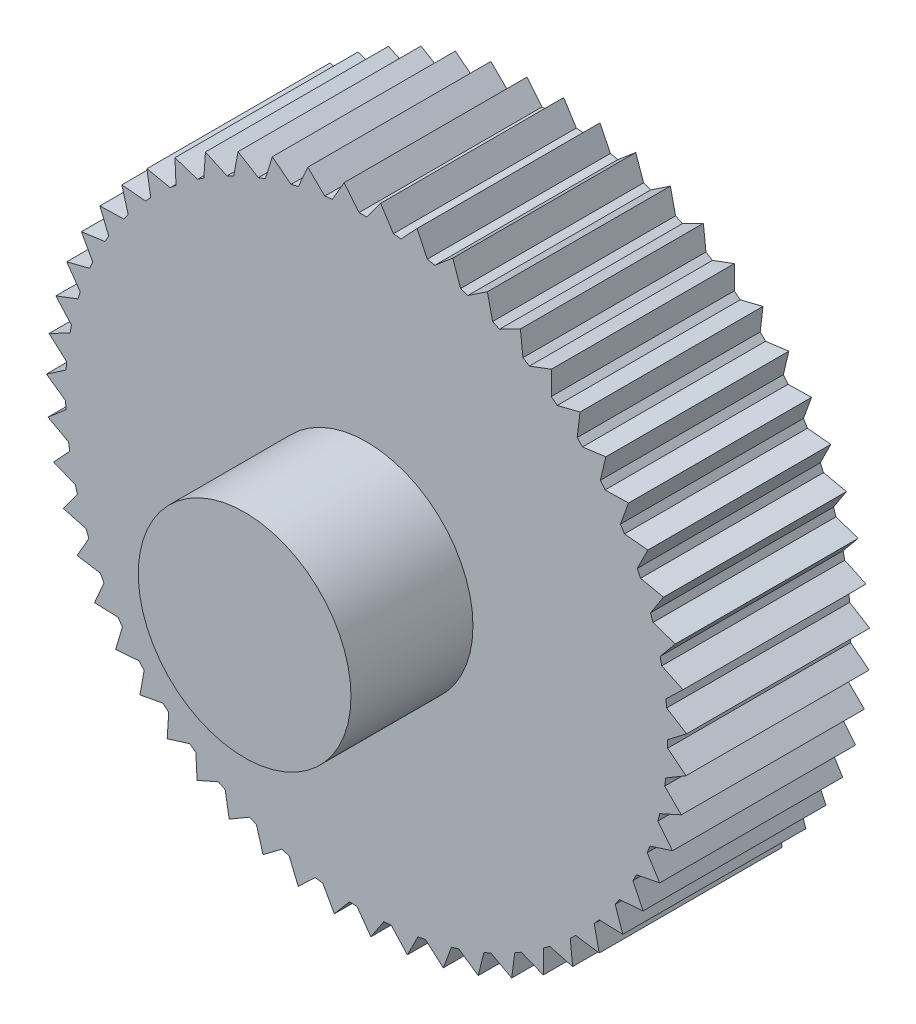
from build123d import *

# Parameters (mm, degrees)
SKETCH1_R           = 8.717247156
BOSS_EXTRUDE1_DEPTH = 15
SKETCH2_R           = 8.717247156
BOSS_EXTRUDE2_DEPTH = 10
FILLET1_R           = 1
BOSS_EXTRUDE3_START = 5
SKETCH3_R           = 8.717247156
BOSS_EXTRUDE3_DEPTH = 5


with BuildPart() as part:
    # Sketch1 → Boss-Extrude1 (new body)
    with BuildSketch(Plane.XY):
        with BuildLine():
            Line((0, 24.68), (1.150167037, 26.224271033))
            Line((1.150167037, 26.224271033), (2.192302243, 24.582437041))
            ThreePointArc((2.192302243, 24.582437041), (2.503005281, 24.552746579), (2.813307996, 24.519129228))
            Line((2.813307996, 24.519129228), (4.132011572, 25.922225132))
            Line((4.132011572, 25.922225132), (4.980198894, 24.172298587))
            ThreePointArc((4.980198894, 24.172298587), (5.285492229, 24.107384178), (5.58994022, 24.03861411))
            Line((5.58994022, 24.03861411), (7.059989017, 25.282243384))
            Line((7.059989017, 25.282243384), (7.703171035, 23.447037254))
            ThreePointArc((7.703171035, 23.447037254), (7.999074703, 23.347745156), (8.293699025, 23.244718895))
            Line((8.293699025, 23.244718895), (9.895928709, 24.312668928))
            Line((9.895928709, 24.312668928), (10.325720562, 22.416107933))
            ThreePointArc((10.325720562, 22.416107933), (10.608377006, 22.283732571), (10.889336779, 22.14779322))
            Line((10.889336779, 22.14779322), (12.602859836, 23.026141652))
            Line((12.602859836, 23.026141652), (12.81365853, 21.092950364))
            ThreePointArc((12.81365853, 21.092950364), (13.07938289, 20.929217453), (13.343015375, 20.76213719))
            Line((13.343015375, 20.76213719), (15.145493411, 21.439433406))
            Line((15.145493411, 21.439433406), (15.134550864, 19.49481393))
            ThreePointArc((15.134550864, 19.49481393), (15.379879016, 19.301857979), (15.62274736, 19.105814951))
            Line((15.62274736, 19.105814951), (17.490682318, 19.573229357))
            Line((17.490682318, 19.573229357), (17.258141181, 17.642532782))
            ThreePointArc((17.258141181, 17.642532782), (17.479874899, 17.422869267), (17.698812941, 17.200419194))
            Line((17.698812941, 17.200419194), (19.607853432, 17.451858331))
            Line((19.607853432, 17.451858331), (19.156745236, 15.560254239))
            ThreePointArc((19.156745236, 15.560254239), (19.351993881, 15.31674681), (19.544147429, 15.070789669))
            Line((19.544147429, 15.070789669), (21.469406191, 15.102975642))
            Line((21.469406191, 15.102975642), (20.805611819, 13.275123985))
            ThreePointArc((20.805611819, 13.275123985), (20.971830027, 13.010947134), (21.134694067, 12.744689353))
            Line((21.134694067, 12.744689353), (23.051072406, 12.557202569))
            Line((23.051072406, 12.557202569), (22.183245435, 10.816932189))
            ThreePointArc((22.183245435, 10.816932189), (22.318266296, 10.535529865), (22.449717645, 10.252442521))
            Line((22.449717645, 10.252442521), (24.332232641, 9.847727156))
            Line((24.332232641, 9.847727156), (23.271686521, 8.217725139))
            ThreePointArc((23.271686521, 8.217725139), (23.373749833, 7.922765851), (23.472074822, 7.626539421))
            Line((23.472074822, 7.626539421), (25.296185012, 7.009871559))
            Line((25.296185012, 7.009871559), (24.056745584, 5.511387475))
            ThreePointArc((24.056745584, 5.511387475), (24.124520796, 5.206716469), (24.188437608, 4.901212717))
            Line((24.188437608, 4.901212717), (25.930362925, 4.080631567))
            Line((25.930362925, 4.080631567), (24.528188179, 2.733200446))
            ThreePointArc((24.528188179, 2.733200446), (24.560791736, 2.422789574), (24.589467118, 2.111991209))
            Line((24.589467118, 2.111991209), (26.226498903, 1.098194302))
            Line((26.226498903, 1.098194302), (24.679868329, -0.08061803))
            ThreePointArc((24.679868329, -0.08061803), (24.676875194, -0.392722087), (24.669935319, -0.704763334))
            Line((24.669935319, -0.704763334), (26.180732359, -1.898559606))
            Line((26.180732359, -1.898559606), (24.509808653, -2.893385527))
            ThreePointArc((24.509808653, -2.893385527), (24.471257847, -3.203114016), (24.428793186, -3.512330209))
            Line((24.428793186, -3.512330209), (25.793659931, -4.870562885))
            Line((25.793659931, -4.870562885), (24.020226138, -5.668433319))
            ThreePointArc((24.020226138, -5.668433319), (23.946620229, -5.971748455), (23.869184374, -6.274108488))
            Line((23.869184374, -6.274108488), (25.070327698, -7.779070929))
            Line((25.070327698, -7.779070929), (23.217503241, -8.369584414))
            ThreePointArc((23.217503241, -8.369584414), (23.109801795, -8.66253202), (22.998404241, -8.954094168))
            Line((22.998404241, -8.954094168), (24.020165405, -10.586166887))
            Line((24.020165405, -10.586166887), (22.112104683, -10.961625176))
            ThreePointArc((22.112104683, -10.961625176), (21.971711753, -11.240386232), (21.827804737, -11.517349537))
            Line((21.827804737, -11.517349537), (22.656863521, -13.25525597))
            Line((22.656863521, -13.25525597), (20.718441024, -13.410764391))
            ThreePointArc((20.718441024, -13.410764391), (20.547186846, -13.671704821), (20.372646417, -13.930458642))
            Line((20.372646417, -13.930458642), (20.998194772, -15.75154252))
            Line((20.998194772, -15.75154252), (19.054680802, -15.685073782))
            ThreePointArc((19.054680802, -15.685073782), (18.854797937, -15.924791828), (18.651899495, -16.161962914))
            Line((18.651899495, -16.161962914), (19.065782441, -18.042483624))
            Line((19.065782441, -18.042483624), (17.142513675, -17.75490425))
            ThreePointArc((17.142513675, -17.75490425), (16.916607901, -17.970274821), (16.687996539, -18.182771283))
            Line((16.687996539, -18.182771283), (16.884818479, -20.098213362))
            Line((16.884818479, -20.098213362), (15.006867666, -19.593272388))
            ThreePointArc((15.006867666, -19.593272388), (14.757884011, -19.781487799), (14.506540027, -19.966539421))
            Line((14.506540027, -19.966539421), (14.483735086, -21.891932153))
            Line((14.483735086, -21.891932153), (12.675584187, -21.176212256))
            ThreePointArc((12.675584187, -21.176212256), (12.406768533, -21.334818831), (12.13596858, -21.490013183))
            Line((12.13596858, -21.490013183), (11.893834057, -23.400256128))
            Line((11.893834057, -23.400256128), (10.179055083, -22.483087813))
            ThreePointArc((10.179055083, -22.483087813), (9.893911854, -22.610017873), (9.607186224, -22.733331759))
            Line((9.607186224, -22.733331759), (9.148878711, -24.603521979))
            Line((9.148878711, -24.603521979), (7.54982643, -23.496861937))
            ThreePointArc((7.54982643, -23.496861937), (7.252072903, -23.590460754), (6.953159503, -23.680286589))
            Line((6.953159503, -23.680286589), (6.284653739, -25.486043294))
            Line((6.284653739, -25.486043294), (4.822174243, -24.204318531))
            ThreePointArc((4.822174243, -24.204318531), (4.515692091, -24.263365903), (4.208487714, -24.318532669))
            Line((4.208487714, -24.318532669), (3.338498695, -26.03631506))
            Line((3.338498695, -26.03631506), (2.03165764, -24.596234818))
            ThreePointArc((2.03165764, -24.596234818), (1.720442327, -24.619960971), (1.408951852, -24.639749485))
            Line((1.408951852, -24.639749485), (0.348821215, -26.247163641))
            Line((0.348821215, -26.247163641), (-0.785344727, -24.667501569))
            ThreePointArc((-0.785344727, -24.667501569), (-1.097236034, -24.655597196), (-1.408951852, -24.639749485))
            Line((-1.408951852, -24.639749485), (-2.645403683, -26.115840304))
            Line((-2.645403683, -26.115840304), (-3.592108925, -24.417189713))
            ThreePointArc((-3.592108925, -24.417189713), (-3.900610245, -24.369810006), (-4.208487714, -24.318532669))
            Line((-4.208487714, -24.318532669), (-5.605141698, -25.64405705))
            Line((-5.605141698, -25.64405705), (-6.352044489, -23.848562447))
            ThreePointArc((-6.352044489, -23.848562447), (-6.653134036, -23.766325073), (-6.953159503, -23.680286589))
            Line((-6.953159503, -23.680286589), (-8.491808119, -24.837964294))
            Line((-8.491808119, -24.837964294), (-9.029171439, -22.969032699))
            ThreePointArc((-9.029171439, -22.969032699), (-9.318924051, -22.853009748), (-9.607186224, -22.733331759))
            Line((-9.607186224, -22.733331759), (-11.267770836, -23.70807069))
            Line((-11.267770836, -23.70807069), (-11.588589331, -21.790066483))
            ThreePointArc((-11.588589331, -21.790066483), (-11.863227639, -21.641770491), (-12.13596858, -21.490013183))
            Line((-12.13596858, -21.490013183), (-13.896840927, -22.269106127))
            Line((-13.896840927, -22.269106127), (-13.996932239, -20.327033426))
            ThreePointArc((-13.996932239, -20.327033426), (-14.252875913, -20.148397659), (-14.506540027, -19.966539421))
            Line((-14.506540027, -19.966539421), (-16.344744444, -20.539829709))
            Line((-16.344744444, -20.539829709), (-16.222803729, -18.599006402))
            ThreePointArc((-16.222803729, -18.599006402), (-16.456716152, -18.39235965), (-16.687996539, -18.182771283))
            Line((-16.687996539, -18.182771283), (-18.579569222, -18.5427852))
            Line((-18.579569222, -18.5427852), (-18.237186164, -16.628512887))
            ThreePointArc((-18.237186164, -16.628512887), (-18.446017928, -16.396549106), (-18.651899495, -16.161962914))
            Line((-18.651899495, -16.161962914), (-20.572180901, -16.304007128))
            Line((-20.572180901, -16.304007128), (-20.013818986, -14.441241276))
            ThreePointArc((-20.013818986, -14.441241276), (-20.194847651, -14.186984469), (-20.372646417, -13.930458642))
            Line((-20.372646417, -13.930458642), (-22.296602741, -13.852681389))
            Line((-22.296602741, -13.852681389), (-21.529541071, -12.065706))
            ThreePointArc((-21.529541071, -12.065706), (-21.680406652, -11.792470794), (-21.827804737, -11.517349537))
            Line((-21.827804737, -11.517349537), (-23.730354265, -11.220764763))
            Line((-23.730354265, -11.220764763), (-22.764592663, -9.532875794))
            ThreePointArc((-22.764592663, -9.532875794), (-22.883328395, -9.244224227), (-22.998404241, -8.954094168))
            Line((-22.998404241, -8.954094168), (-24.854744331, -8.442568309))
            Line((-24.854744331, -8.442568309), (-23.702872975, -6.875769973))
            ThreePointArc((-23.702872975, -6.875769973), (-23.787930958, -6.57546506), (-23.869184374, -6.274108488))
            Line((-23.869184374, -6.274108488), (-25.655114795, -5.554310066))
            Line((-25.655114795, -5.554310066), (-24.332150089, -4.129027976))
            ThreePointArc((-24.332150089, -4.129027976), (-24.382421461, -3.82098465), (-24.428793186, -3.512330209))
            Line((-24.428793186, -3.512330209), (-26.121031602, -2.593642896))
            Line((-26.121031602, -2.593642896), (-24.644220416, -1.328457785))
            ThreePointArc((-24.644220416, -1.328457785), (-24.659049813, -1.016691862), (-24.669935319, -0.704763334))
            Line((-24.669935319, -0.704763334), (-26.246420816, 0.400836374))
            Line((-26.246420816, 0.400836374), (-24.635015641, 1.489430886))
            ThreePointArc((-24.635015641, 1.489430886), (-24.614209739, 1.800855059), (-24.589467118, 2.111991209))
            Line((-24.589467118, 2.111991209), (-26.029647795, 3.39009013))
            Line((-26.029647795, 3.39009013), (-24.304655763, 4.287902546))
            ThreePointArc((-24.304655763, 4.287902546), (-24.248485798, 4.59492508), (-24.188437608, 4.901212717))
            Line((-24.188437608, 4.901212717), (-25.473538508, 6.335148877))
            Line((-25.473538508, 6.335148877), (-23.657447528, 7.03047484))
            ThreePointArc((-23.657447528, 7.03047484), (-23.566645762, 7.329093227), (-23.472074822, 7.626539421))
            Line((-23.472074822, 7.626539421), (-24.585342691, 9.197619269))
            Line((-24.585342691, 9.197619269), (-22.701828284, 9.681394143))
            ThreePointArc((-22.701828284, 9.681394143), (-22.577578458, 9.967715434), (-22.449717645, 10.252442521))
            Line((-22.449717645, 10.252442521), (-23.376639332, 11.940184629))
            Line((-23.376639332, 11.940184629), (-21.450255992, 12.206101667))
            ThreePointArc((-21.450255992, 12.206101667), (-21.294177891, 12.476393227), (-21.134694067, 12.744689353))
            Line((-21.134694067, 12.744689353), (-21.86318573, 14.527091421))
            Line((-21.86318573, 14.527091421), (-19.919046808, 14.571683989))
            ThreePointArc((-19.919046808, 14.571683989), (-19.733175149, 14.822422155), (-19.544147429, 15.070789669))
            Line((-19.544147429, 15.070789669), (-20.064712067, 16.924615361))
            Line((-20.064712067, 16.924615361), (-18.128162387, 16.747302125))
            ThreePointArc((-18.128162387, 16.747302125), (-17.914920292, 16.975218141), (-17.698812941, 17.200419194))
            Line((-17.698812941, 17.200419194), (-18.004664197, 19.101501056))
            Line((-18.004664197, 19.101501056), (-16.100949646, 18.704593567))
            ThreePointArc((-16.100949646, 18.704593567), (-15.863117051, 18.906716199), (-15.62274736, 19.105814951))
            Line((-15.62274736, 19.105814951), (-15.709897994, 21.029369474))
            Line((-15.709897994, 21.029369474), (-13.863836403, 20.418042027))
            ThreePointArc((-13.863836403, 20.418042027), (-13.60451382, 20.591736297), (-13.343015375, 20.76213719))
            Line((-13.343015375, 20.76213719), (-13.210329246, 22.683087899))
            Line((-13.210329246, 22.683087899), (-11.44598685, 21.865310083))
            ThreePointArc((-11.44598685, 21.865310083), (-11.168554946, 22.008311621), (-10.889336779, 22.14779322))
            Line((-10.889336779, 22.14779322), (-10.538543653, 24.041097585))
            Line((-10.538543653, 24.041097585), (-8.878921354, 23.027530384))
            ThreePointArc((-8.878921354, 23.027530384), (-8.586996878, 23.137974946), (-8.293699025, 23.244718895))
            Line((-8.293699025, 23.244718895), (-7.729372028, 25.085694798))
            Line((-7.729372028, 25.085694798), (-6.196105541, 23.88955161))
            ThreePointArc((-6.196105541, 23.88955161), (-5.893494174, 23.965999383), (-5.58994022, 24.03861411))
            Line((-5.58994022, 24.03861411), (-4.819436217, 25.803261615))
            Line((-4.819436217, 25.803261615), (-3.432514015, 24.440135997))
            ThreePointArc((-3.432514015, 24.440135997), (-3.12316076, 24.481590366), (-2.813307996, 24.519129228))
            Line((-2.813307996, 24.519129228), (-1.846671685, 26.184443456))
            Line((-1.846671685, 26.184443456), (-0.62417442, 24.672105834))
            ThreePointArc((-0.62417442, 24.672105834), (-0.312112169, 24.67802638), (0, 24.68))
        make_face()
        Circle(SKETCH1_R, mode=Mode.SUBTRACT)
    extrude(amount=BOSS_EXTRUDE1_DEPTH)

    # Fillet1
    fillet1_edges = [part.edges().sort_by_distance(p)[0] for p in [
        (-8.717247156, 0, 0),
    ]]
    fillet(fillet1_edges, radius=FILLET1_R)



with BuildPart() as body_2:
    # Sketch2 → Boss-Extrude2 (new body)
    with BuildSketch(Plane.XY.offset(15)):
        Circle(SKETCH2_R)
    extrude(amount=BOSS_EXTRUDE2_DEPTH)


with BuildPart() as part_1:
    add(part.part)

    add(body_2.part)  # Boss-Extrude3 merges body 2
    # Sketch3 → Boss-Extrude3 (add)
    with BuildSketch(Plane(origin=(0, 0, 15), x_dir=(-1, 0, 0), z_dir=(0, 0, -1)).offset(BOSS_EXTRUDE3_START)):
        Circle(SKETCH3_R)
    extrude(amount=-BOSS_EXTRUDE3_DEPTH)


solid = part_1.part
